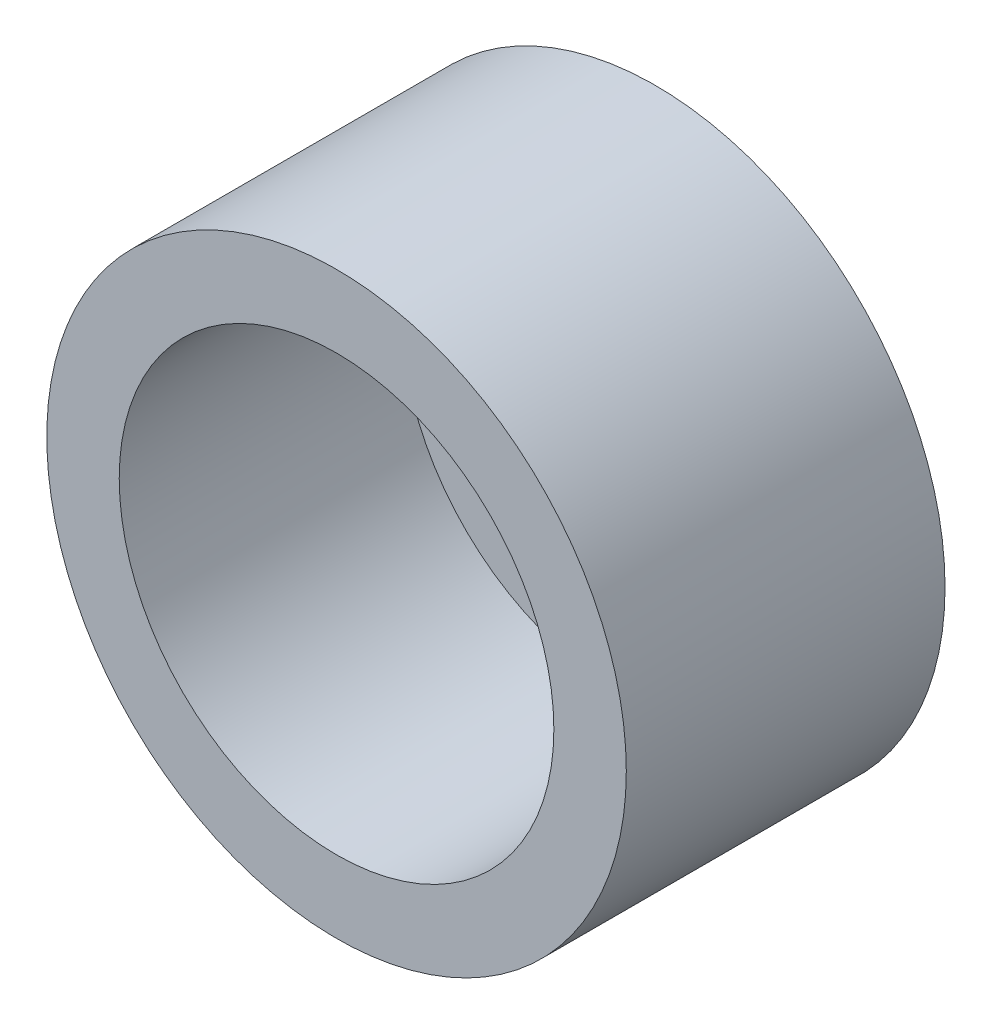
from build123d import *

# Parameters (mm, degrees)
ESQUISSE1_R             = 20
ESQUISSE1_R_2           = 15
BOSS_EXTRU_1_DEPTH      = 22
ESQUISSE5_R             = 15
BOSS_EXTRU_3_DEPTH      = 2.5
ESQUISSE12_R            = 4.25
ENL_V_MAT_EXTRU_2_DEPTH = 2.5


with BuildPart() as part:
    # Esquisse1 → Boss.-Extru.1 (new body)
    with BuildSketch(Plane.XY):
        Circle(ESQUISSE1_R)
        Circle(ESQUISSE1_R_2, mode=Mode.SUBTRACT)
    extrude(amount=BOSS_EXTRU_1_DEPTH)

    # Esquisse5 → Boss.-Extru.3 (add)
    with BuildSketch(Plane(origin=(0, 0, 0), x_dir=(-1, 0, 0), z_dir=(0, 0, -1))):
        Circle(ESQUISSE5_R)
    extrude(amount=-BOSS_EXTRU_3_DEPTH)

    # Esquisse12 → Enlèv. mat.-Extru.2 (cut)
    with BuildSketch(Plane(origin=(0, 0, 0), x_dir=(-1, 0, 0), z_dir=(0, 0, -1))):
        Circle(ESQUISSE12_R)
    extrude(amount=-ENL_V_MAT_EXTRU_2_DEPTH, mode=Mode.SUBTRACT)


solid = part.part
